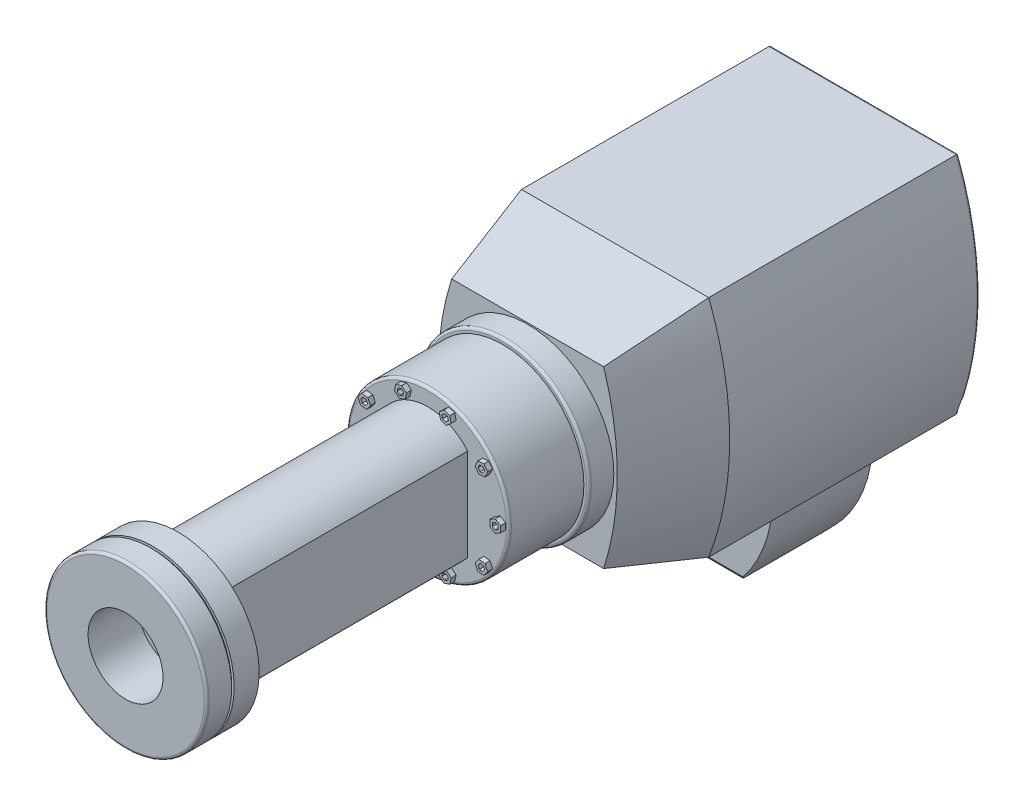
from build123d import *

# Parameters (mm, degrees)
BOSS_EXTRUDE1_DEPTH  = 100
SKETCH4_R            = 34.5
BOSS_EXTRUDE2_DEPTH  = 10
SKETCH5_R            = 32.5
BOSS_EXTRUDE3_DEPTH  = 30
BOSS_EXTRUDE4_DEPTH  = 2
CIRPATTERN1_COUNT    = 10
BOSS_EXTRUDE5_DEPTH  = 100
SKETCH9_R            = 32.5
BOSS_EXTRUDE6_DEPTH  = 10
SKETCH10_R           = 31.5
BOSS_EXTRUDE7_DEPTH  = 1
SKETCH11_R           = 32.5
BOSS_EXTRUDE8_DEPTH  = 10
SKETCH14_R           = 42.5
BOSS_EXTRUDE9_DEPTH  = 10.5
BOSS_EXTRUDE10_DEPTH = 35
BOSS_EXTRUDE11_DEPTH = 20
CUT_EXTRUDE1_DEPTH   = 314.700892617
FILLET2_R            = 1
SKETCH20_R           = 15
CUT_EXTRUDE2_DEPTH   = 20
SKETCH21_R           = 15
CUT_EXTRUDE3_DEPTH   = 20


with BuildPart() as part:
    # Sketch1 → Boss-Extrude1 (new body)
    with BuildSketch(Plane.XY):
        with BuildLine():
            Line((37.5, 45), (-37.5, 45))
            ThreePointArc((-37.5, 45), (-45.880962103, 0), (-37.5, -45))
            Line((-37.5, -45), (37.5, -45))
            ThreePointArc((37.5, -45), (45.880962103, 0), (37.5, 45))
        make_face()
    extrude(amount=BOSS_EXTRUDE1_DEPTH)

    # Sketch3 for Loft1 → Loft1 section 0
    with BuildSketch(Plane.XY.offset(135)):
        with BuildLine():
            Line((-30.425473604, -35), (30.425473604, -35))
            # circular arc as an exact rational Bezier (weights 1, cos(half-angle), 1)
            Bezier((30.425473604, -35), (41.608142487, 0), (30.425473604, 35), weights=[1, 0.95256097, 1])
            Line((30.425473604, 35), (-30.425473604, 35))
            Bezier((-30.425473604, 35), (-41.608142487, 0), (-30.425473604, -35), weights=[1, 0.95256097, 1])
        make_face()
    # Sketch2 for Loft1 → Loft1 section 1
    with BuildSketch(Plane.XY.offset(100)):
        with BuildLine():
            Line((-37.5, -45), (37.5, -45))
            Bezier((37.5, -45), (54.864231746, 0), (37.5, 45), weights=[1, 0.932952303, 1])
            Line((37.5, 45), (-37.5, 45))
            Bezier((-37.5, 45), (-54.864231746, 0), (-37.5, -45), weights=[1, 0.932952303, 1])
        make_face()
    loft()

    # Sketch4 → Boss-Extrude2 (add)
    with BuildSketch(Plane.XY.offset(135)):
        Circle(SKETCH4_R)
    extrude(amount=BOSS_EXTRUDE2_DEPTH)

    # Sketch5 → Boss-Extrude3 (add)
    with BuildSketch(Plane.XY.offset(145)):
        Circle(SKETCH5_R)
    extrude(amount=BOSS_EXTRUDE3_DEPTH)

    # Sketch6 → Boss-Extrude4 (add)
    with BuildSketch(Plane.XY.offset(175)):
        Polygon((29, -2.5), (31.165063509, -1.25), (31.165063509, 1.25), (29, 2.5), (26.834936491, 1.25), (26.834936491, -1.25), align=None)
        Polygon((29, 1.345299462), (27.834936491, 0.672649731), (27.834936491, -0.672649731), (29, -1.345299462), (30.165063509, -0.672649731), (30.165063509, 0.672649731), align=None, mode=Mode.SUBTRACT)
    boss_extrude4 = extrude(amount=BOSS_EXTRUDE4_DEPTH)

    # CirPattern1: Boss-Extrude4 ×10 about axis
    cirpattern1_axis = Axis((0, 0, 0), (0, 0, 1))
    for i in range(1, CIRPATTERN1_COUNT):
        add(boss_extrude4.rotate(cirpattern1_axis, i * 360 / CIRPATTERN1_COUNT))

    # Sketch7 → Boss-Extrude5 (add)
    with BuildSketch(Plane.XY.offset(175)):
        with BuildLine():
            Line((16, -18.5), (16, 18.5))
            ThreePointArc((16, 18.5), (0, 25.898529491), (-16, 18.5))
            Line((-16, 18.5), (-16, -18.5))
            ThreePointArc((-16, -18.5), (0, -25.898529491), (16, -18.5))
        make_face()
    extrude(amount=BOSS_EXTRUDE5_DEPTH)

    # Sketch9 → Boss-Extrude6 (add)
    with BuildSketch(Plane.XY.offset(275)):
        Circle(SKETCH9_R)
    extrude(amount=BOSS_EXTRUDE6_DEPTH)

    # Sketch10 → Boss-Extrude7 (add)
    with BuildSketch(Plane.XY.offset(285)):
        Circle(SKETCH10_R)
    extrude(amount=BOSS_EXTRUDE7_DEPTH)

    # Sketch11 → Boss-Extrude8 (add)
    with BuildSketch(Plane.XY.offset(286)):
        Circle(SKETCH11_R)
    extrude(amount=BOSS_EXTRUDE8_DEPTH)

    # Sketch14 → Boss-Extrude9 (add, symmetric)
    with BuildSketch(Plane(origin=(-37.5, 0, 0), x_dir=(0, 0, -1), z_dir=(1, 0, 0))):
        with Locations((-50, -45)):
            Circle(SKETCH14_R)
    extrude(amount=BOSS_EXTRUDE9_DEPTH, both=True)

    # Sketch15 → Boss-Extrude10 (add)
    with BuildSketch(Plane(origin=(-27, 0, 0), x_dir=(0, 0, -1), z_dir=(1, 0, 0))):
        with BuildLine():
            Line((-70, -45), (-70, -75))
            ThreePointArc((-70, -75), (-50, -85.128852225), (-30, -75))
            Line((-30, -75), (-30, -45))
            Line((-30, -45), (-70, -45))
        make_face()
    extrude(amount=BOSS_EXTRUDE10_DEPTH)

    # Sketch16 → Boss-Extrude11 (add, symmetric)
    with BuildSketch(Plane.XY.offset(50)):
        with BuildLine():
            Line((8, -87), (8, -45))
            Line((8, -45), (33, -45))
            ThreePointArc((33, -45), (25.421855105, -68.929675658), (8, -87))
        make_face()
    extrude(amount=BOSS_EXTRUDE11_DEPTH, both=True)

    # Sketch19 → Cut-Extrude1 (cut, through all)
    with BuildSketch(Plane.ZY.offset(-8)):
        with BuildLine():
            Line((70, -87), (70, -75))
            ThreePointArc((70, -75), (50, -85.128852225), (30, -75))
            Line((30, -75), (30, -87))
            Line((30, -87), (70, -87))
        make_face()
    extrude(amount=-CUT_EXTRUDE1_DEPTH, mode=Mode.SUBTRACT)

    # Fillet2
    fillet2_edges = [part.edges().sort_by_distance(p)[0] for p in [
        (-34.5, 0, 145),
        (-32.5, 0, 175),
        (-32.5, 0, 296),
        (-48, -45, 92.5),
        (-27, -87.5, 50),
        (0, 45, 0),
        (45.880962103, 0, 0),
        (0, -45, 0),
        (-45.880962103, 0, 0),
    ]]
    fillet(fillet2_edges, radius=FILLET2_R)

    # Sketch20 → Cut-Extrude2 (cut)
    with BuildSketch(Plane.XY.offset(296)):
        Circle(SKETCH20_R)
    extrude(amount=-CUT_EXTRUDE2_DEPTH, mode=Mode.SUBTRACT)

    # Sketch21 → Cut-Extrude3 (cut)
    with BuildSketch(Plane.ZY.offset(48)):
        with Locations((50, -45)):
            Circle(SKETCH21_R)
    extrude(amount=-CUT_EXTRUDE3_DEPTH, mode=Mode.SUBTRACT)


solid = part.part
